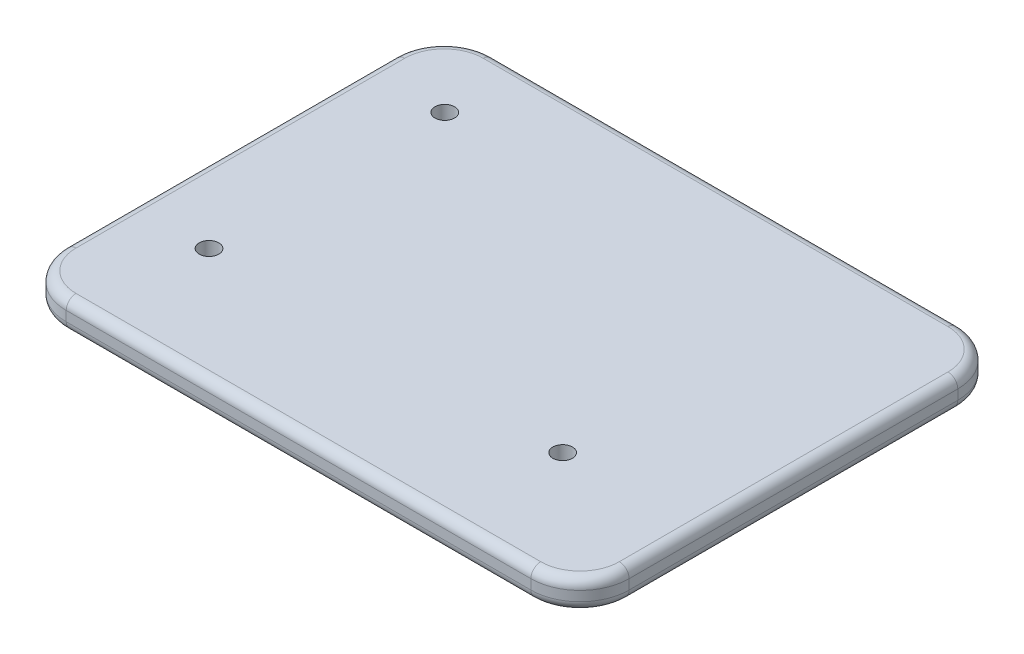
from build123d import *

# Parameters (mm, degrees)
SKETCH1_R           = 1
BOSS_EXTRUDE1_DEPTH = 3
FILLET1_R           = 1


with BuildPart() as part:
    # Sketch1 → Boss-Extrude1 (new body)
    with BuildSketch(Plane(origin=(0, 0, 0), x_dir=(-1, 0, 0), z_dir=(0, 1, 0))):
        with BuildLine():
            Line((-31.655, 18.23), (-31.655, -15.23))
            ThreePointArc((-31.655, -15.23), (-30.190533906, -18.765533906), (-26.655, -20.23))
            Line((-26.655, -20.23), (20.655, -20.23))
            ThreePointArc((20.655, -20.23), (24.190533906, -18.765533906), (25.655, -15.23))
            Line((25.655, -15.23), (25.655, 18.23))
            ThreePointArc((25.655, 18.23), (24.190533906, 21.765533906), (20.655, 23.23))
            Line((20.655, 23.23), (-26.655, 23.23))
            ThreePointArc((-26.655, 23.23), (-30.190533906, 21.765533906), (-31.655, 18.23))
        make_face()
        with Locations(Location((-18.155, 11.5, 0), (0, 0, 90))):
            Circle(SKETCH1_R, mode=Mode.SUBTRACT)
        with Locations(Location((17.845, 11.5, 0), (0, 0, 90))):
            Circle(SKETCH1_R, mode=Mode.SUBTRACT)
        with Locations(Location((17.845, -12.5, 0), (0, 0, 90))):
            Circle(SKETCH1_R, mode=Mode.SUBTRACT)
    extrude(amount=BOSS_EXTRUDE1_DEPTH)

    # Fillet1
    fillet1_edges = [part.edges().sort_by_distance(p)[0] for p in [
        (30.190533906, 3, -18.765533906),
        (31.655, 0, 1.5),
        (30.190533906, 0, 21.765533906),
        (3, 3, -20.23),
        (-24.190533906, 3, -18.765533906),
        (-25.655, 3, 1.5),
        (-24.190533906, 3, 21.765533906),
        (3, 3, 23.23),
        (30.190533906, 3, 21.765533906),
        (31.655, 3, 1.5),
        (3, 0, 23.23),
        (-24.190533906, 0, 21.765533906),
        (-25.655, 0, 1.5),
        (-24.190533906, 0, -18.765533906),
        (3, 0, -20.23),
        (30.190533906, 0, -18.765533906),
    ]]
    fillet(fillet1_edges, radius=FILLET1_R)


solid = part.part
